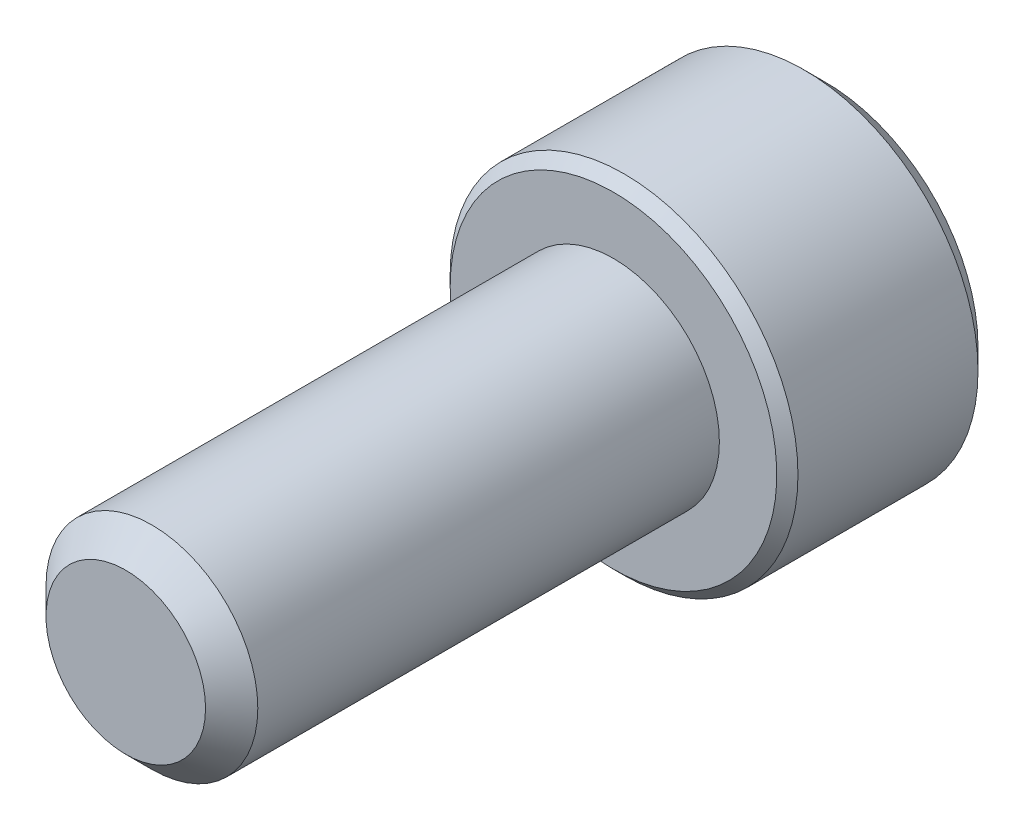
from build123d import *

# Parameters (mm, degrees)
SKETCH1_R          = 2.413
EXTRUDE1_DEPTH     = 11.1125
CHAMFER3_SIZE      = 0.5953125
SKETCH6_R          = 3.9624
EXTRUDE2_DEPTH     = 4.826
CUT_EXTRUDE1_DEPTH = 2.9765625
SKETCH8_R          = 2.291358881
CUT_EXTRUDE2_DEPTH = 0.4826
CUT_EXTRUDE2_DRAFT = -45
CHAMFER1_SIZE      = 0.4826
CHAMFER2_SIZE      = 0.2413


with BuildPart() as part:
    # Sketch1 → Extrude1 (new body)
    with BuildSketch(Plane.XY):
        Circle(SKETCH1_R)
    extrude(amount=-EXTRUDE1_DEPTH)

    # Chamfer3
    chamfer3_edges = [part.edges().sort_by_distance(p)[0] for p in [
        (-2.413, 0, 0),
    ]]
    chamfer(chamfer3_edges, length=CHAMFER3_SIZE)

    # Sketch6 → Extrude2 (add)
    with BuildSketch(Plane(origin=(0, 0, -11.1125), x_dir=(-1, 0, 0), z_dir=(0, 0, -1))):
        Circle(SKETCH6_R)
    extrude(amount=EXTRUDE2_DEPTH)

    # Sketch7 → Cut-Extrude1 (cut)
    with BuildSketch(Plane(origin=(0, 0, -15.9385), x_dir=(-1, 0, 0), z_dir=(0, 0, -1))):
        Polygon((0, 2.291358881), (-1.984375, 1.14567944), (-1.984375, -1.14567944), (0, -2.291358881), (1.984375, -1.14567944), (1.984375, 1.14567944), align=None)
    extrude(amount=-CUT_EXTRUDE1_DEPTH, mode=Mode.SUBTRACT)


with BuildPart() as cut_extrude2_tool:
    # Sketch8 → Cut-Extrude2 (with draft: the straight prism first)
    with BuildSketch(Plane(origin=(0, 0, -15.9385), x_dir=(-1, 0, 0), z_dir=(0, 0, -1))):
        Circle(SKETCH8_R)
    extrude(amount=-CUT_EXTRUDE2_DEPTH)
    # Cut-Extrude2: the draft: its side faces are tilted about the plane it starts from
    cut_extrude2_sides = [cut_extrude2_tool.faces().sort_by_distance(p)[0] for p in [
        (2.291358881, 0, -15.6972),
    ]]
    draft(cut_extrude2_sides, Plane(origin=(0, 0, -15.9385), x_dir=(-1, 0, 0), z_dir=(0, 0, -1)), CUT_EXTRUDE2_DRAFT)


with BuildPart() as part_1:
    add(part.part)

    # Cut-Extrude2: cut by cut_extrude2_tool
    add(cut_extrude2_tool.part, mode=Mode.SUBTRACT)

    # Chamfer1
    chamfer1_edges = [part_1.edges().sort_by_distance(p)[0] for p in [
        (3.9624, 0, -15.9385),
    ]]
    chamfer(chamfer1_edges, length=CHAMFER1_SIZE)

    # Chamfer2
    chamfer2_edges = [part_1.edges().sort_by_distance(p)[0] for p in [
        (3.9624, 0, -11.1125),
    ]]
    chamfer(chamfer2_edges, length=CHAMFER2_SIZE)


solid = part_1.part
